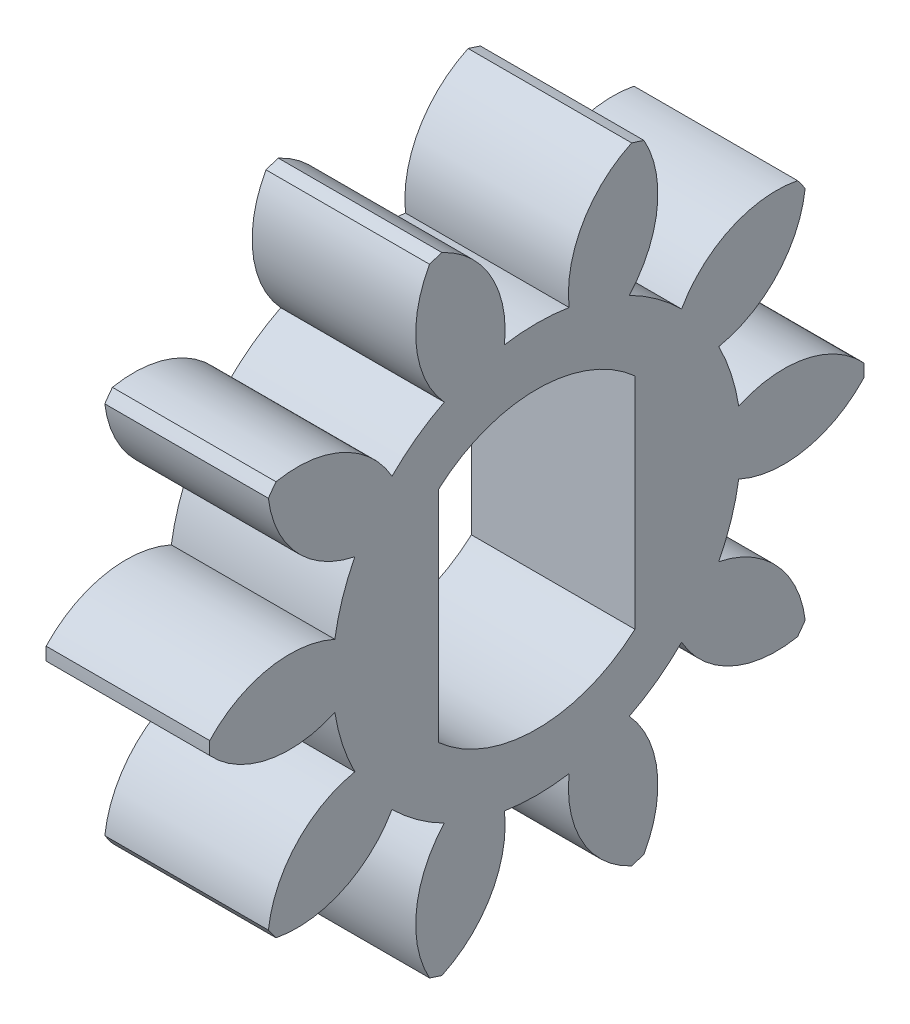
from build123d import *

# Parameters (mm, degrees)
BASPROSKE_W         = 3
BASPROSKE_H         = 6
TOOTHCUT_DEPTH      = 10
TEETHCUTS_COUNT     = 10
BORSKE_R            = 3
BORE_DEPTH          = 50.0000508
SKETCH1_R           = 3
BOSS_EXTRUDE1_DEPTH = 3
CUT_EXTRUDE1_DEPTH  = 3
SKETCH3_R           = 3
CUT_EXTRUDE2_DEPTH  = 3
SKETCH4_R           = 3
BOSS_EXTRUDE2_DEPTH = 3
CUT_EXTRUDE3_DEPTH  = 3


with BuildPart() as part:
    # BasProSke → Base-Revolve (revolve)
    with BuildSketch(Plane(origin=(0, 0, 0), x_dir=(1, 0, 0), z_dir=(0, 1, 0)), mode=Mode.PRIVATE) as base_revolve_sk:
        with Locations((1.5, 3)):
            Rectangle(BASPROSKE_W, BASPROSKE_H)
    revolve(base_revolve_sk.sketch.rotate(Axis((-10, 0, 0), (1, 0, 0)), 180), axis=Axis((-10, 0, 0), (1, 0, 0)))

    # TooCutSke → ToothCut (cut, through all)
    with BuildSketch(Plane(origin=(0, 0, 0), x_dir=(0, 0, -1), z_dir=(1, 0, 0))):
        with BuildLine():
            ThreePointArc((0.59278292, 3.701838653), (0, 3.749), (-0.59278292, 3.701838653))
            ThreePointArc((-0.59278292, 3.701838653), (-0.846593509, 4.924114224), (-1.775771316, 5.757784417))
            ThreePointArc((-1.775771316, 5.757784417), (0, 6.0254), (1.775771316, 5.757784417))
            ThreePointArc((1.775771316, 5.757784417), (0.846593509, 4.924114224), (0.59278292, 3.701838653))
        make_face()
    toothcut = extrude(amount=TOOTHCUT_DEPTH, mode=Mode.SUBTRACT)

    # TeethCuts: ToothCut ×10 about axis
    teethcuts_axis = Axis((0, 0, 0), (1, 0, 0))
    for i in range(1, TEETHCUTS_COUNT):
        add(toothcut.rotate(teethcuts_axis, i * 360 / TEETHCUTS_COUNT), mode=Mode.SUBTRACT)

    # BorSke → Bore (cut, symmetric)
    with BuildSketch(Plane(origin=(0, 0, 0), x_dir=(0, 0, -1), z_dir=(1, 0, 0))):
        with Locations(Location((0, 0, 0), (0, 0, 180))):
            Circle(BORSKE_R)
    extrude(amount=BORE_DEPTH, both=True, mode=Mode.SUBTRACT)

    # Sketch1 → Boss-Extrude1 (add)
    with BuildSketch(Plane(origin=(3, 0, 0), x_dir=(0, 0, -1), z_dir=(1, 0, 0))):
        Circle(SKETCH1_R)
    extrude(amount=-BOSS_EXTRUDE1_DEPTH)

    # Sketch2 → Cut-Extrude1 (cut)
    with BuildSketch(Plane(origin=(3, 0, 0), x_dir=(0, 0, -1), z_dir=(1, 0, 0))):
        with BuildLine():
            ThreePointArc((1.8, 2.01246118), (0, 2.7), (-1.8, 2.01246118))
            Line((-1.8, 2.01246118), (-1.8, 0))
            Line((-1.8, 0), (1.8, 0))
            Line((1.8, 0), (1.8, 2.01246118))
        make_face()
        with BuildLine():
            Line((1.8, 0), (-1.8, 0))
            Line((-1.8, 0), (-1.8, -2.01246118))
            ThreePointArc((-1.8, -2.01246118), (0, -2.7), (1.8, -2.01246118))
            Line((1.8, -2.01246118), (1.8, 0))
        make_face()
    extrude(amount=-CUT_EXTRUDE1_DEPTH, mode=Mode.SUBTRACT)

    # Sketch3 → Cut-Extrude2 (cut)
    with BuildSketch(Plane(origin=(3, 0, 0), x_dir=(0, 0, -1), z_dir=(1, 0, 0))):
        Circle(SKETCH3_R)
    extrude(amount=-CUT_EXTRUDE2_DEPTH, mode=Mode.SUBTRACT)

    # Sketch4 → Boss-Extrude2 (add)
    with BuildSketch(Plane(origin=(3, 0, 0), x_dir=(0, 0, -1), z_dir=(1, 0, 0))):
        Circle(SKETCH4_R)
    extrude(amount=-BOSS_EXTRUDE2_DEPTH)

    # Sketch5 → Cut-Extrude3 (cut)
    with BuildSketch(Plane(origin=(3, 0, 0), x_dir=(0, 0, -1), z_dir=(1, 0, 0))):
        with BuildLine():
            ThreePointArc((1.8, 2.01246118), (0, 2.7), (-1.8, 2.01246118))
            Line((-1.8, 2.01246118), (-1.8, 0))
            Line((-1.8, 0), (1.8, 0))
            Line((1.8, 0), (1.8, 2.01246118))
        make_face()
        with BuildLine():
            Line((1.8, 0), (-1.8, 0))
            Line((-1.8, 0), (-1.8, -2.01246118))
            ThreePointArc((-1.8, -2.01246118), (0, -2.7), (1.8, -2.01246118))
            Line((1.8, -2.01246118), (1.8, 0))
        make_face()
    extrude(amount=-CUT_EXTRUDE3_DEPTH, mode=Mode.SUBTRACT)


solid = part.part
